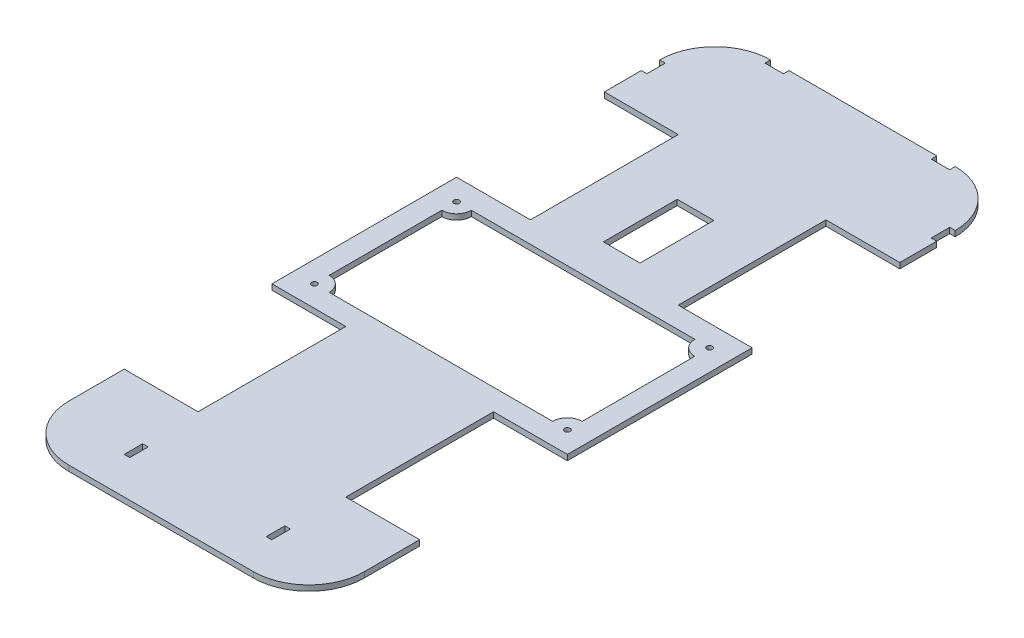
from build123d import *

# Parameters (mm, degrees)
RESSALTO_EXTRUS_O1_DEPTH = 3
ESBO_O2_R                = 1.5
ESBO_O2_W                = 3
ESBO_O2_H                = 10
ESBO_O2_W_2              = 10
ESBO_O2_H_2              = 3
ESBO_O2_H_3              = 10.102691272
CORTE_EXTRUS_O2_DEPTH    = 3


with BuildPart() as part:
    # Esboço1 → Ressalto-extrusão1 (new body)
    with BuildSketch(Plane(origin=(0, 0, 0), x_dir=(1, 0, 0), z_dir=(0, 1, 0))):
        with BuildLine():
            Line((-25.82411142, -23.300209544), (74.17588858, -23.300209544))
            ThreePointArc((74.17588858, -23.300209544), (95.389092016, -14.513412979), (104.17588858, 6.699790456))
            Line((104.17588858, 6.699790456), (104.17588858, 36.699790456))
            Line((104.17588858, 36.699790456), (64.17588858, 36.699790456))
            Line((64.17588858, 36.699790456), (64.17588858, 116.699790456))
            Line((64.17588858, 116.699790456), (104.17588858, 116.699790456))
            Line((104.17588858, 116.699790456), (104.17588858, 216.699790456))
            Line((104.17588858, 216.699790456), (64.17588858, 216.699790456))
            Line((64.17588858, 216.699790456), (64.17588858, 296.699790456))
            Line((64.17588858, 296.699790456), (104.17588858, 296.699790456))
            Line((104.17588858, 296.699790456), (104.17588858, 326.699790456))
            ThreePointArc((104.17588858, 326.699790456), (95.389092016, 347.912993892), (74.17588858, 356.699790456))
            Line((74.17588858, 356.699790456), (-25.82411142, 356.699790456))
            ThreePointArc((-25.82411142, 356.699790456), (-47.037314855, 347.912993892), (-55.82411142, 326.699790456))
            Line((-55.82411142, 326.699790456), (-55.82411142, 296.699790456))
            Line((-55.82411142, 296.699790456), (-15.82411142, 296.699790456))
            Line((-15.82411142, 296.699790456), (-15.82411142, 216.699790456))
            Line((-15.82411142, 216.699790456), (-55.82411142, 216.699790456))
            Line((-55.82411142, 216.699790456), (-55.82411142, 116.699790456))
            Line((-55.82411142, 116.699790456), (-15.82411142, 116.699790456))
            Line((-15.82411142, 116.699790456), (-15.82411142, 36.699790456))
            Line((-15.82411142, 36.699790456), (-55.82411142, 36.699790456))
            Line((-55.82411142, 36.699790456), (-55.82411142, 6.699790456))
            ThreePointArc((-55.82411142, 6.699790456), (-47.037314855, -14.513412979), (-25.82411142, -23.300209544))
        make_face()
    extrude(amount=RESSALTO_EXTRUS_O1_DEPTH)

    # Esboço2 → Corte-extrusão2 (cut)
    with BuildSketch(Plane(origin=(0, 3, 0), x_dir=(1, 0, 0), z_dir=(0, 1, 0))):
        with Locations(Location((-44.32411142, 205.199790456, 0), (0, 0, 270))):
            Circle(ESBO_O2_R)
        with Locations(Location((-44.32411142, 128.199790456, 0), (0, 0, 270))):
            Circle(ESBO_O2_R)
        with Locations(Location((92.67588858, 128.199790456, 0), (0, 0, 270))):
            Circle(ESBO_O2_R)
        with Locations(Location((92.67588858, 205.199790456, 0), (0, 0, 270))):
            Circle(ESBO_O2_R)
        with Locations((102.67588858, 321.699790456)):
            Rectangle(ESBO_O2_W, ESBO_O2_H)
        with Locations((69.17588858, 355.199790456)):
            Rectangle(ESBO_O2_W_2, ESBO_O2_H_2)
        with BuildLine():
            Line((-36.32411142, 205.199790456), (84.67588858, 205.199790456))
            ThreePointArc((84.67588858, 205.199790456), (87.019034331, 199.542936207), (92.67588858, 197.199790456))
            Line((92.67588858, 197.199790456), (92.67588858, 136.199790456))
            ThreePointArc((92.67588858, 136.199790456), (87.019034331, 133.856644706), (84.67588858, 128.199790456))
            Line((84.67588858, 128.199790456), (-36.32411142, 128.199790456))
            ThreePointArc((-36.32411142, 128.199790456), (-38.66725717, 133.856644706), (-44.32411142, 136.199790456))
            Line((-44.32411142, 136.199790456), (-44.32411142, 197.199790456))
            ThreePointArc((-44.32411142, 197.199790456), (-38.66725717, 199.542936207), (-36.32411142, 205.199790456))
        make_face()
        with Locations((-14.32411142, 1.699790456)):
            Rectangle(ESBO_O2_W, ESBO_O2_H)
        with Locations((62.67588858, 1.64844482)):
            Rectangle(ESBO_O2_W, ESBO_O2_H_3)
        with Locations((-20.82411142, 355.199790456)):
            Rectangle(ESBO_O2_W_2, ESBO_O2_H_2)
        with Locations((-54.32411142, 321.699790456)):
            Rectangle(ESBO_O2_W, ESBO_O2_H)
        Polygon((34.10088858, 256.699790456), (34.10088858, 266.099790456), (14.25088858, 266.099790456), (14.25088858, 256.699790456), (14.25088858, 226.099790456), (34.10088858, 226.099790456), align=None)
    extrude(amount=-CORTE_EXTRUS_O2_DEPTH, mode=Mode.SUBTRACT)


solid = part.part
